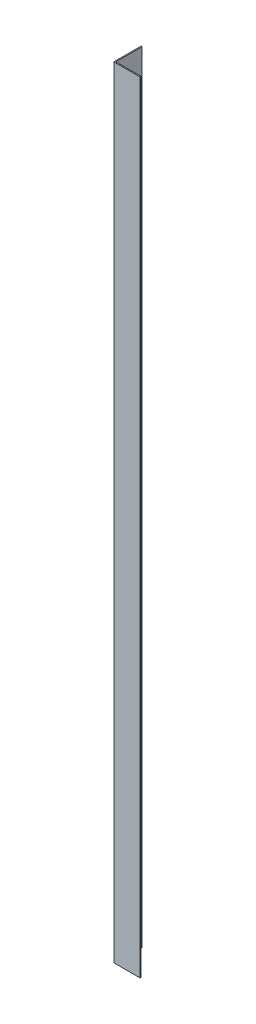
from build123d import *

# Parameters (mm, degrees)
BOSS_EXTRUDE1_DEPTH = 740


with BuildPart() as part:
    # Sketch1 → Boss-Extrude1 (new body)
    with BuildSketch(Plane(origin=(0, 0, 0), x_dir=(1, 0, 0), z_dir=(0, 1, 0))):
        Polygon((-12.5, 12.5), (-11.5, 12.5), (-11.5, 11.5), (-11.5, -12.5), (12.5, -12.5), (12.5, -13.5), (-11.5, -13.5), (-12.5, -13.5), (-12.5, -12.5), align=None)
    extrude(amount=BOSS_EXTRUDE1_DEPTH)


solid = part.part
